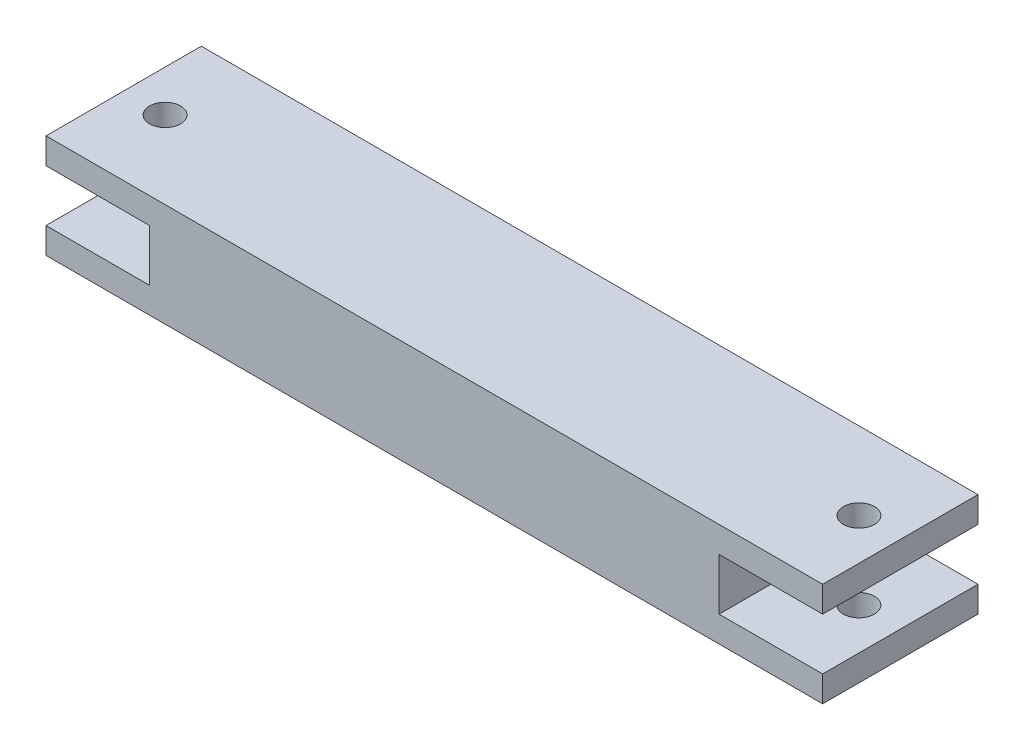
from build123d import *

# Parameters (mm, degrees)
SKETCH1_W           = 150
SKETCH1_H           = 30
BOSS_EXTRUDE1_DEPTH = 20
SKETCH2_R           = 3
CUT_EXTRUDE1_DEPTH  = 20
SKETCH3_W           = 30
SKETCH3_H           = 10
CUT_EXTRUDE2_DEPTH  = 20
SKETCH4_W           = 30
SKETCH4_H           = 10
CUT_EXTRUDE3_DEPTH  = 20


with BuildPart() as part:
    # Sketch1 → Boss-Extrude1 (new body)
    with BuildSketch(Plane(origin=(0, 0, 0), x_dir=(1, 0, 0), z_dir=(0, 1, 0))):
        with Locations((16.197183099, 2.077464789)):
            Rectangle(SKETCH1_W, SKETCH1_H)
    extrude(amount=BOSS_EXTRUDE1_DEPTH)

    # Sketch2 → Cut-Extrude1 (cut)
    with BuildSketch(Plane(origin=(0, 20, 0), x_dir=(1, 0, 0), z_dir=(0, 1, 0))):
        with Locations(Location((-50.802816901, 2.077464789, 0), (0, 0, 270))):
            Circle(SKETCH2_R)
        with Locations(Location((83.197183099, 2.077464789, 0), (0, 0, 90))):
            Circle(SKETCH2_R)
    extrude(amount=-CUT_EXTRUDE1_DEPTH, mode=Mode.SUBTRACT)

    # Sketch3 → Cut-Extrude2 (cut)
    with BuildSketch(Plane.ZY.offset(58.802816901)):
        with Locations((-2.077464789, 10)):
            Rectangle(SKETCH3_W, SKETCH3_H)
    extrude(amount=-CUT_EXTRUDE2_DEPTH, mode=Mode.SUBTRACT)

    # Sketch4 → Cut-Extrude3 (cut)
    with BuildSketch(Plane(origin=(91.197183099, 0, 0), x_dir=(0, 0, -1), z_dir=(1, 0, 0))):
        with Locations((2.077464789, 10)):
            Rectangle(SKETCH4_W, SKETCH4_H)
    extrude(amount=-CUT_EXTRUDE3_DEPTH, mode=Mode.SUBTRACT)


solid = part.part
